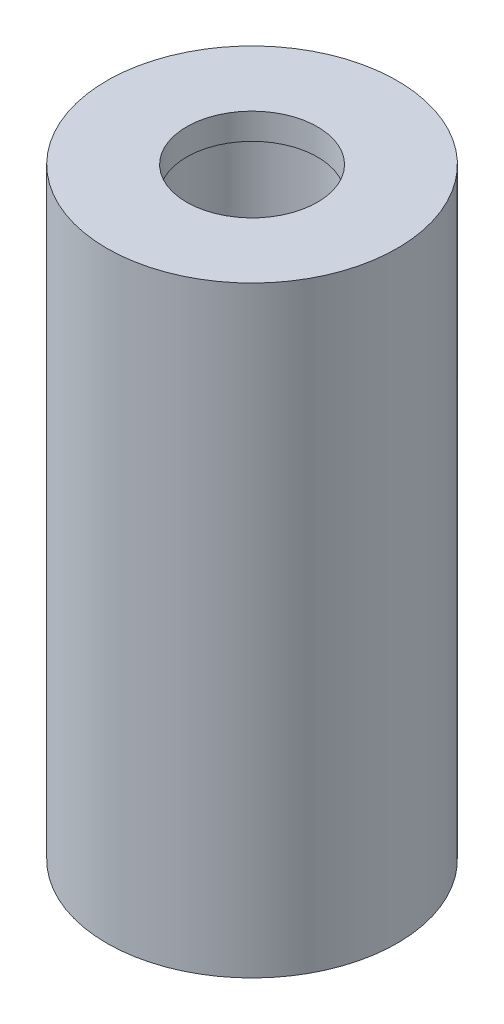
from build123d import *

# Parameters (mm, degrees)
SKETCH_1_R      = 5.55
SKETCH_1_R_2    = 2.55
EXTRUDE_1_DEPTH = 23
EXTRUDE_START   = -1
SKETCH_2_R      = 2.55
SKETCH_2_R_2    = 2.5
EXTRUDE_2_DEPTH = 1


with BuildPart() as part:
    # 草图1 → 凸台-拉伸1 (new body)
    with BuildSketch(Plane(origin=(0, 0, 0), x_dir=(1, 0, 0), z_dir=(0, 1, 0))):
        with Locations(Location((0, 0, 0), (0, 0, 270))):
            Circle(SKETCH_1_R)
        with Locations(Location((0, 0, 0), (0, 0, 270))):
            Circle(SKETCH_1_R_2, mode=Mode.SUBTRACT)
    extrude(amount=EXTRUDE_1_DEPTH)

    # 草图2 → 凸台-拉伸2 (add)
    with BuildSketch(Plane(origin=(0, 23, 0), x_dir=(1, 0, 0), z_dir=(0, 1, 0)).offset(EXTRUDE_START)):
        with Locations(Location((0, 0, 0), (0, 0, 270))):
            Circle(SKETCH_2_R)
        with Locations(Location((0, 0, 0), (0, 0, 270))):
            Circle(SKETCH_2_R_2, mode=Mode.SUBTRACT)
    extrude(amount=EXTRUDE_2_DEPTH)


solid = part.part
